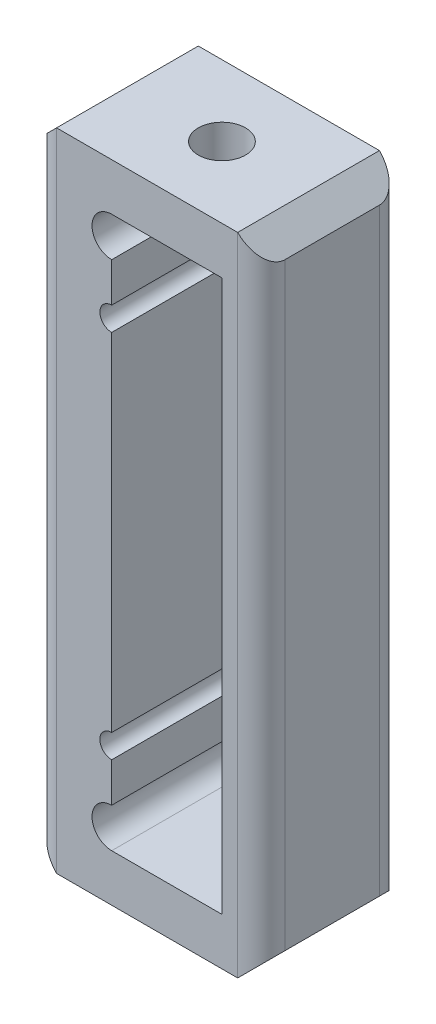
from build123d import *

# Parameters (mm, degrees)
SKETCH_1_W          = 29
SKETCH_1_H          = 82
EXTRUDE_1_DEPTH     = 18
CHAMFER_1_SIZE      = 3
FILLET_1_R          = 3
SKETCH_2_R          = 3
CUT_EXTRUDE_1_DEPTH = 5
CUT_EXTRUDE_START   = -5
SKETCH_3_R          = 3
CUT_EXTRUDE_2_DEPTH = 5


with BuildPart() as part:
    # 草图1 → 凸台-拉伸1 (new body)
    with BuildSketch(Plane.XY):
        with Locations((-13.005076144, -29.675385896)):
            Rectangle(SKETCH_1_W, SKETCH_1_H)
        with BuildLine():
            Line((-3.505076144, 5.324614104), (-3.505076144, -64.675385896))
            Line((-3.505076144, -64.675385896), (-17.505076144, -64.675385896))
            ThreePointArc((-17.505076144, -64.675385896), (-20.005076144, -62.175385896), (-17.505076144, -59.675385896))
            Line((-17.505076144, -59.675385896), (-17.505076144, -54.675385896))
            ThreePointArc((-17.505076144, -54.675385896), (-19.005076144, -53.175385896), (-17.505076144, -51.675385896))
            Line((-17.505076144, -51.675385896), (-17.505076144, -7.675385896))
            ThreePointArc((-17.505076144, -7.675385896), (-19.005076144, -6.175385896), (-17.505076144, -4.675385896))
            Line((-17.505076144, -4.675385896), (-17.505076144, 0.324614104))
            ThreePointArc((-17.505076144, 0.324614104), (-20.005076144, 2.824614104), (-17.505076144, 5.324614104))
            Line((-17.505076144, 5.324614104), (-3.505076144, 5.324614104))
        make_face(mode=Mode.SUBTRACT)
    extrude(amount=EXTRUDE_1_DEPTH)

    # 倒角1
    chamfer_1_edges = [part.edges().sort_by_distance(p)[0] for p in [
        (1.494923856, 11.324614104, 9),
        (1.494923856, -70.675385896, 9),
        (-27.505076144, -70.675385896, 9),
        (-27.505076144, 11.324614104, 9),
    ]]
    chamfer(chamfer_1_edges, length=CHAMFER_1_SIZE)

    # 圆角1
    fillet_1_edges = [part.edges().sort_by_distance(p)[0] for p in [
        (-27.505076144, -29.675385896, 0),
        (-27.505076144, -29.675385896, 18),
        (1.494923856, -29.675385896, 0),
        (1.494923856, -29.675385896, 18),
    ]]
    fillet(fillet_1_edges, radius=FILLET_1_R)

    # 草图2 → 切除-拉伸1 (cut)
    with BuildSketch(Plane.XZ.offset(70.675385896)):
        with Locations(Location((-12.505076144, 9, 0), (0, 0, 270))):
            Circle(SKETCH_2_R)
    extrude(amount=-CUT_EXTRUDE_1_DEPTH, mode=Mode.SUBTRACT)

    # 草图3 → 切除-拉伸2 (cut)
    with BuildSketch(Plane(origin=(0, 11.324614104, 0), x_dir=(1, 0, 0), z_dir=(0, 1, 0)).offset(CUT_EXTRUDE_START)):
        with Locations(Location((-12.505076144, -9, 0), (0, 0, 90))):
            Circle(SKETCH_3_R)
    extrude(amount=CUT_EXTRUDE_2_DEPTH, mode=Mode.SUBTRACT)


solid = part.part
